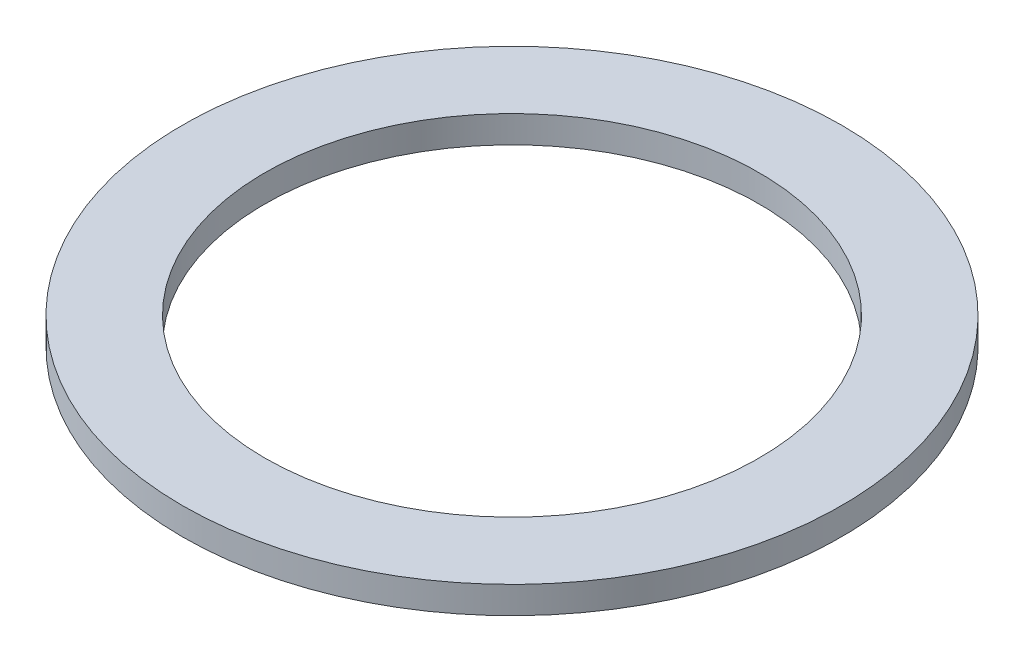
from build123d import *

# Parameters (mm, degrees)
SKETCH1_R           = 19.304
SKETCH1_R_2         = 14.478
BOSS_EXTRUDE1_DEPTH = 0.79375


with BuildPart() as part:
    # Sketch1 → Boss-Extrude1 (new, symmetric)
    with BuildSketch(Plane(origin=(0, 0, 0), x_dir=(1, 0, 0), z_dir=(0, 1, 0))):
        with Locations(Location((0, 0, 0), (0, 0, 270))):
            Circle(SKETCH1_R)
        with Locations(Location((0, 0, 0), (0, 0, 270))):
            Circle(SKETCH1_R_2, mode=Mode.SUBTRACT)
    extrude(amount=BOSS_EXTRUDE1_DEPTH, both=True)


solid = part.part
